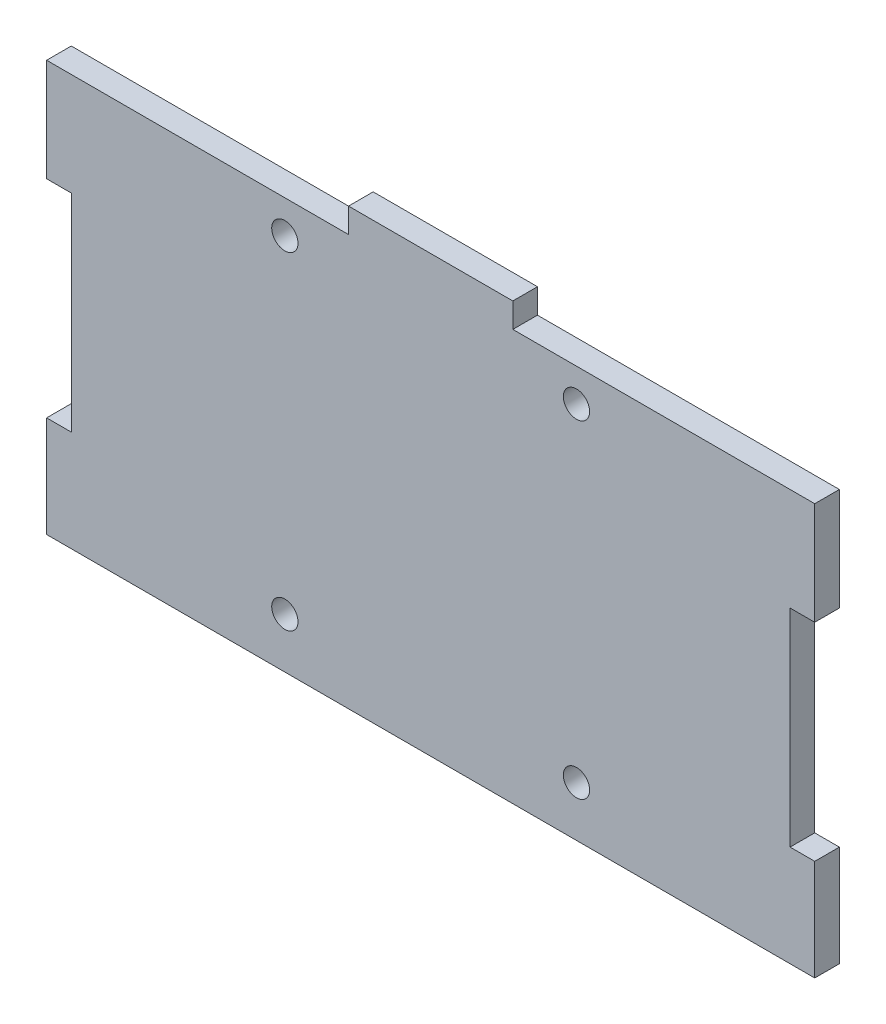
from build123d import *

# Parameters (mm, degrees)
BOSS_EXTRU_1_DEPTH = 3
ESQUISSE2_W        = 20
ESQUISSE2_H        = 3
BOSS_EXTRU_2_DEPTH = 3
SKETCH1_R          = 1.6
CUT_EXTRUDE1_DEPTH = 55.576208186
SKETCH2_R          = 1.6
CUT_EXTRUDE2_DEPTH = 55.576208186
SKETCH3_R          = 1.6
CUT_EXTRUDE3_DEPTH = 55.576208186


with BuildPart() as part:
    # Esquisse1 → Boss.-Extru.1 (new body)
    with BuildSketch(Plane.XY):
        Polygon((46.75, -25), (-46.75, -25), (-46.75, -12.7), (-43.75, -12.7), (-43.75, 12.5), (-46.75, 12.5), (-46.75, 25), (-26.2, 25), (-23, 25), (23, 25), (26.2, 25), (46.75, 25), (46.75, 12.5), (43.75, 12.5), (43.75, -12.7), (46.75, -12.7), align=None)
    extrude(amount=BOSS_EXTRU_1_DEPTH)

    # Esquisse2 → Boss.-Extru.2 (add)
    with BuildSketch(Plane.XY.offset(3)):
        with Locations((0, 26.5)):
            Rectangle(ESQUISSE2_W, ESQUISSE2_H)
    extrude(amount=-BOSS_EXTRU_2_DEPTH)

    # Sketch1 → Cut-Extrude1 (cut, through all)
    with BuildSketch(Plane.XY.offset(3)):
        with Locations((-17.75, 21)):
            Circle(SKETCH1_R)
    extrude(amount=-CUT_EXTRUDE1_DEPTH, mode=Mode.SUBTRACT)

    # Sketch2 → Cut-Extrude2 (cut, through all)
    with BuildSketch(Plane(origin=(0, 0, 0), x_dir=(-1, 0, 0), z_dir=(0, 0, -1))):
        with Locations((-17.75, 21)):
            Circle(SKETCH2_R)
    extrude(amount=-CUT_EXTRUDE2_DEPTH, mode=Mode.SUBTRACT)

    # Sketch3 → Cut-Extrude3 (cut, through all)
    with BuildSketch(Plane.XY.offset(3)):
        with Locations((17.75, -18.9)):
            Circle(SKETCH3_R)
        with Locations((-17.75, -18.9)):
            Circle(SKETCH3_R)
    extrude(amount=-CUT_EXTRUDE3_DEPTH, mode=Mode.SUBTRACT)


solid = part.part
